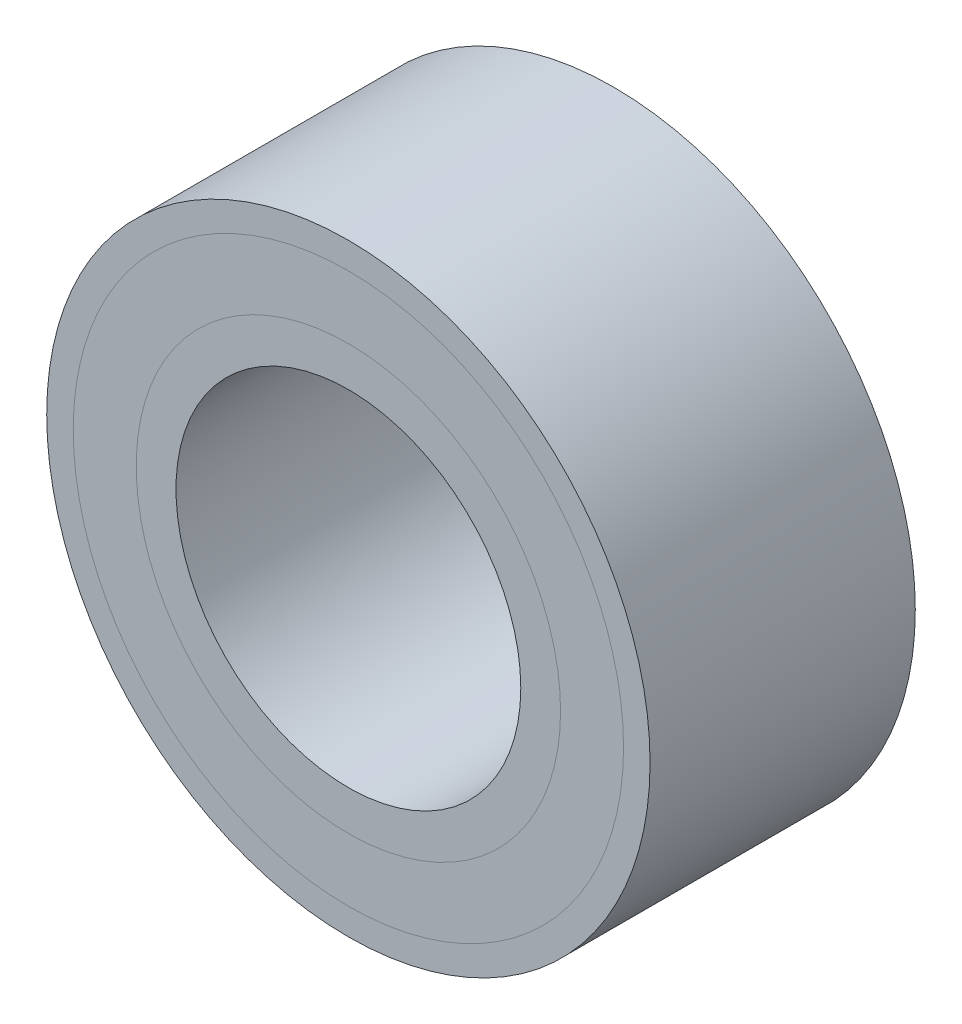
from build123d import *

# Parameters (mm, degrees)
SKETCH1_R             = 45.5
SKETCH1_R_2           = 41.5
BOSS_EXTRUDE1_DEPTH   = 40
SKETCH1_R_3           = 32
SKETCH1_R_4           = 26
BOSS_EXTRUDE1_2_DEPTH = 40
SKETCH1_4_R           = 41.5
SKETCH1_4_R_2         = 32
BOSS_EXTRUDE2_DEPTH   = 40


with BuildPart() as part:
    # Sketch1 → Boss-Extrude1 (new body)
    with BuildSketch(Plane.XY):
        Circle(SKETCH1_R)
        Circle(SKETCH1_R_2, mode=Mode.SUBTRACT)
    extrude(amount=BOSS_EXTRUDE1_DEPTH)


with BuildPart() as body_2:
    # Sketch1 → Boss-Extrude1 2 (new body)
    with BuildSketch(Plane.XY):
        Circle(SKETCH1_R_3)
        Circle(SKETCH1_R_4, mode=Mode.SUBTRACT)
    extrude(amount=BOSS_EXTRUDE1_2_DEPTH)


with BuildPart() as body_3:
    # Sketch1<4> → Boss-Extrude2 (new body)
    with BuildSketch(Plane.XY):
        Circle(SKETCH1_4_R)
        Circle(SKETCH1_4_R_2, mode=Mode.SUBTRACT)
    extrude(amount=BOSS_EXTRUDE2_DEPTH)


solid = Compound([part.part, body_2.part, body_3.part])
